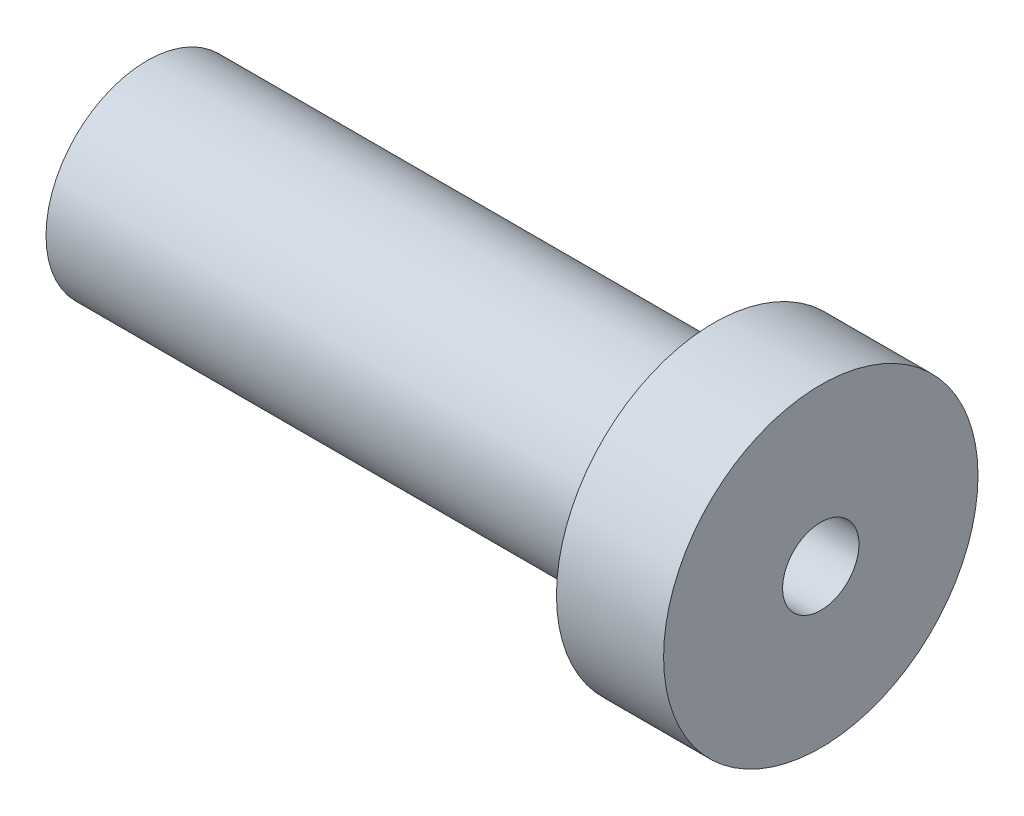
from build123d import *

# Parameters (mm, degrees)
SKETCH2_R          = 1.7
CUT_EXTRUDE2_DEPTH = 32.591137998


with BuildPart() as part:
    # Sketch1 → Revolve1 (revolve)
    with BuildSketch(Plane.XY, mode=Mode.PRIVATE) as revolve1_sk:
        Polygon((0, 0), (0, 4.5), (25.2298663, 4.5), (25.2298663, 7), (30, 7), (30, 0), align=None)
    revolve(revolve1_sk.sketch.rotate(Axis((-5.955223881, 0, 0), (1, 0, 0)), 90), axis=Axis((-5.955223881, 0, 0), (1, 0, 0)))

    # Sketch2 → Cut-Extrude2 (cut, through all)
    with BuildSketch(Plane(origin=(0, 0, 0), x_dir=(0, 0, -1), z_dir=(1, 0, 0))):
        Circle(SKETCH2_R)
    extrude(amount=CUT_EXTRUDE2_DEPTH, mode=Mode.SUBTRACT)


solid = part.part
